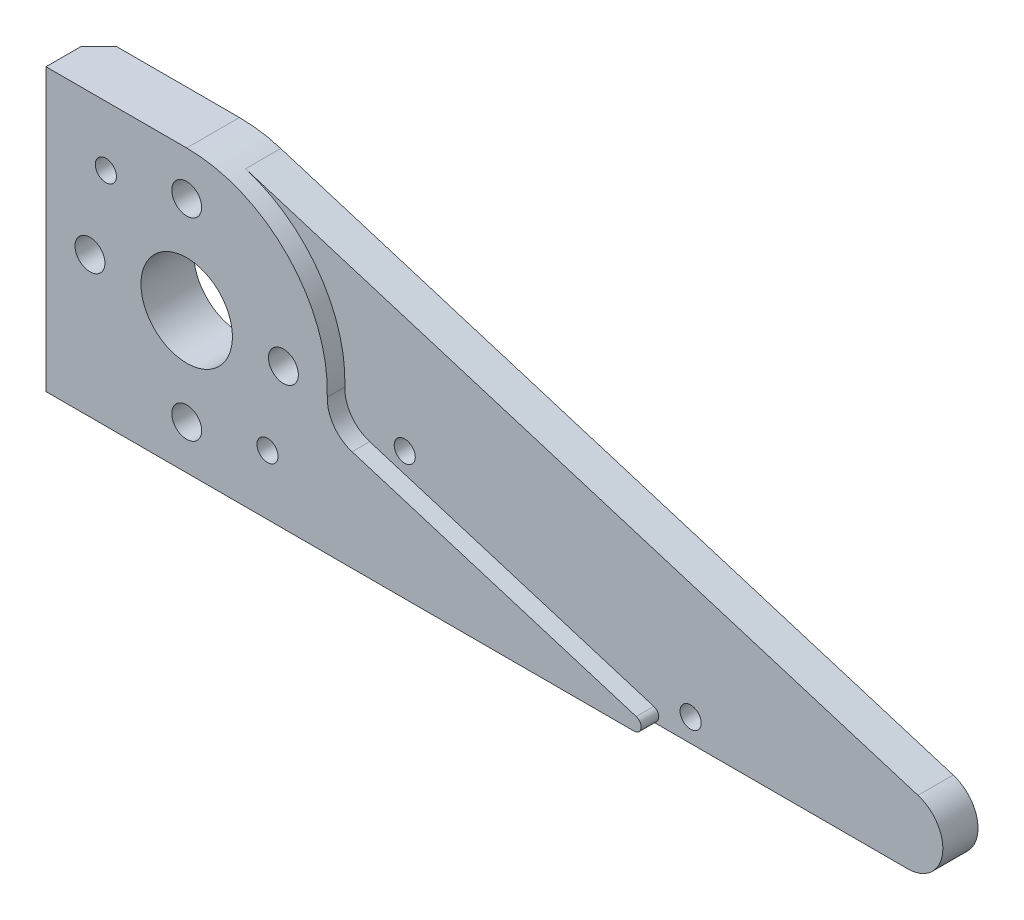
from build123d import *

# Parameters (mm, degrees)
ESTRUSIONE1_DEPTH        = 15
SMUSSO1_SIZE             = 5
SCHIZZO2_R               = 13
TAGLIO_ESTRUSIONE1_DEPTH = 59.523499554
SCHIZZO4_R               = 3
TAGLIO_ESTRUSIONE3_DEPTH = 20
SCHIZZO5_R               = 5.25
TAGLIO_ESTRUSIONE4_DEPTH = 8.5
SCHIZZO6_R               = 2.5
TAGLIO_ESTRUSIONE5_DEPTH = 20
SCHIZZO7_R               = 4.25
TAGLIO_ESTRUSIONE6_DEPTH = 6
ESTRUSIONE2_START        = -15
ESTRUSIONE2_DEPTH        = 15
TAGLIO_ESTRUSIONE7_START = -5
TAGLIO_ESTRUSIONE7_DEPTH = 5
SCHIZZO10_R              = 3
TAGLIO_ESTRUSIONE8_DEPTH = 10
RACCORDO1_R              = 2


with BuildPart() as part:
    # Schizzo1 → Estrusione1 (new body)
    with BuildSketch(Plane.XY):
        with BuildLine():
            Line((-40, 40), (0, 40))
            ThreePointArc((0, 40), (40, 0), (0, -40))
            Line((0, -40), (-40, -40))
            Line((-40, -40), (-40, 40))
        make_face()
    extrude(amount=ESTRUSIONE1_DEPTH)

    # Smusso1
    smusso1_edges = [part.edges().sort_by_distance(p)[0] for p in [
        (-40, 0, 0),
    ]]
    chamfer(smusso1_edges, length=SMUSSO1_SIZE)

    # Schizzo2 → Taglio-Estrusione1 (cut, through all)
    with BuildSketch(Plane(origin=(0, 0, 0), x_dir=(-1, 0, 0), z_dir=(0, 0, -1))):
        Circle(SCHIZZO2_R)
    extrude(amount=-TAGLIO_ESTRUSIONE1_DEPTH, mode=Mode.SUBTRACT)

    # Schizzo4 → Taglio-Estrusione3 (cut)
    with BuildSketch(Plane.XY.offset(15)):
        with Locations((-22.980970389, 22.980970389)):
            Circle(SCHIZZO4_R)
        with Locations((22.980970389, -22.980970389)):
            Circle(SCHIZZO4_R)
    extrude(amount=-TAGLIO_ESTRUSIONE3_DEPTH, mode=Mode.SUBTRACT)

    # Schizzo5 → Taglio-Estrusione4 (cut)
    with BuildSketch(Plane.XY):
        with Locations((-22.980970389, 22.980970389)):
            Circle(SCHIZZO5_R)
        with Locations(Location((22.980970389, -22.980970389, 0), (0, 0, 180))):
            Circle(SCHIZZO5_R)
    extrude(amount=TAGLIO_ESTRUSIONE4_DEPTH, mode=Mode.SUBTRACT)

    # Schizzo6 → Taglio-Estrusione5 (cut)
    with BuildSketch(Plane(origin=(0, 0, 0), x_dir=(-1, 0, 0), z_dir=(0, 0, -1))):
        with Locations((27.5, 0)):
            Circle(SCHIZZO6_R)
        with Locations((0, -27.5)):
            Circle(SCHIZZO6_R)
        with Locations((-27.5, 0)):
            Circle(SCHIZZO6_R)
        with Locations((0, 27.5)):
            Circle(SCHIZZO6_R)
    extrude(amount=-TAGLIO_ESTRUSIONE5_DEPTH, mode=Mode.SUBTRACT)

    # Schizzo7 → Taglio-Estrusione6 (cut)
    with BuildSketch(Plane.XY.offset(15)):
        with Locations((0, 27.5)):
            Circle(SCHIZZO7_R)
        with Locations((-27.5, 0)):
            Circle(SCHIZZO7_R)
        with Locations((27.5, 0)):
            Circle(SCHIZZO7_R)
        with Locations((0, -27.5)):
            Circle(SCHIZZO7_R)
    extrude(amount=-TAGLIO_ESTRUSIONE6_DEPTH, mode=Mode.SUBTRACT)

    # Schizzo8 → Estrusione2 (add)
    with BuildSketch(Plane.XY.offset(15).offset(ESTRUSIONE2_START)):
        with BuildLine():
            Line((11.73594132, 38.239608802), (202.93398533, -20.4400978))
            ThreePointArc((202.93398533, -20.4400978), (209.889363529, -31.483404529), (200, -40))
            Line((200, -40), (0, -40))
            ThreePointArc((0, -40), (39.557454115, -5.933618117), (11.73594132, 38.239608802))
        make_face()
    extrude(amount=ESTRUSIONE2_DEPTH)

    # Schizzo9 → Taglio-Estrusione7 (cut)
    with BuildSketch(Plane.XY.offset(15).offset(TAGLIO_ESTRUSIONE7_START)):
        with BuildLine():
            Line((140.558333333, -40), (200, -40))
            ThreePointArc((200, -40), (209.889363529, -31.483404529), (202.93398533, -20.4400978))
            Line((202.93398533, -20.4400978), (11.73594132, 38.239608802))
            ThreePointArc((11.73594132, 38.239608802), (32.5753606, 23.213054125), (39.975840489, -1.390027772))
            ThreePointArc((39.975840489, -1.390027772), (41.825960461, -7.540798246), (47.035815281, -11.297436915))
            Line((47.035815281, -11.297436915), (140.558333333, -40))
        make_face()
    extrude(amount=TAGLIO_ESTRUSIONE7_DEPTH, mode=Mode.SUBTRACT)

    # Schizzo10 → Taglio-Estrusione8 (cut)
    with BuildSketch(Plane.XY.offset(15)):
        with Locations((57, -8.648405099)):
            Circle(SCHIZZO10_R)
        with Locations((138.285904257, -33.5)):
            Circle(SCHIZZO10_R)
    extrude(amount=-TAGLIO_ESTRUSIONE8_DEPTH, mode=Mode.SUBTRACT)

    # Raccordo1
    raccordo1_edges = [part.edges().sort_by_distance(p)[0] for p in [
        (140.558333333, -40, 12.5),
    ]]
    fillet(raccordo1_edges, radius=RACCORDO1_R)


solid = part.part
